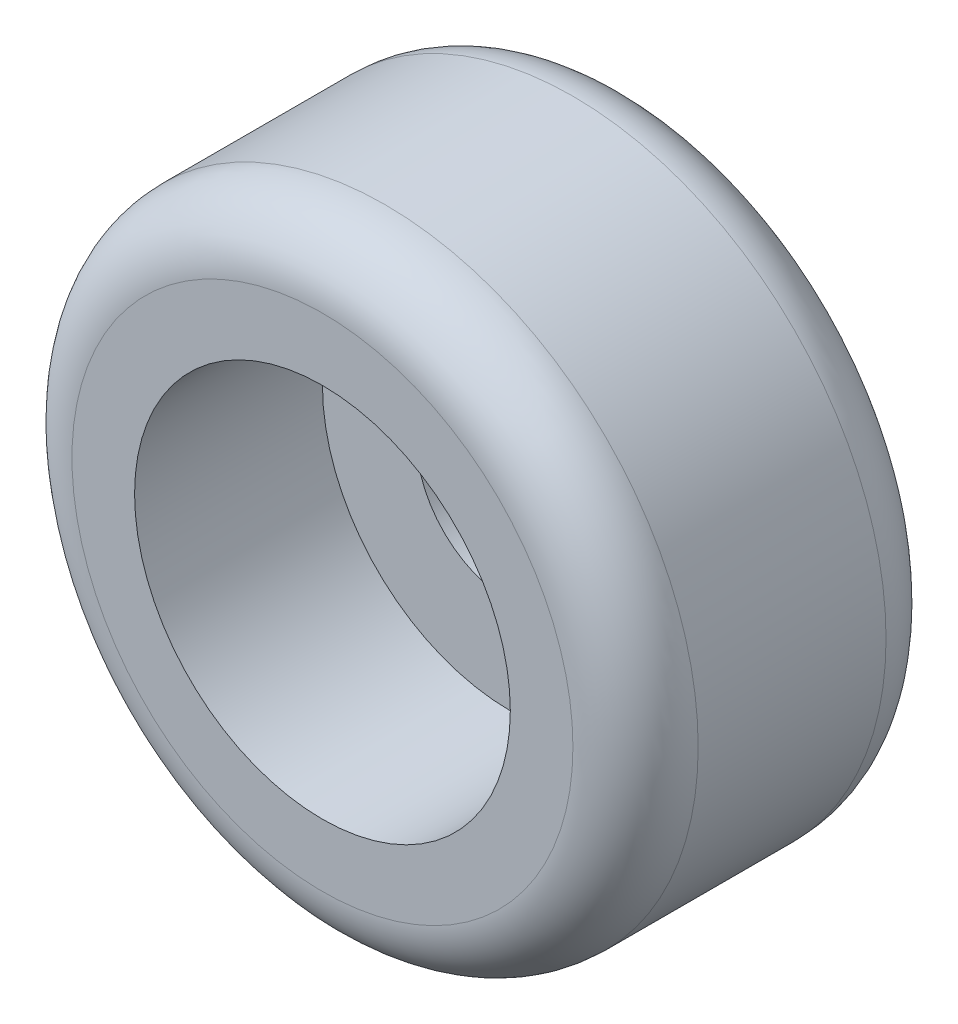
from build123d import *

# Parameters (mm, degrees)
ESQUISSE1_R             = 5
BOSS_EXTRU_1_DEPTH      = 5
ESQUISSE2_R             = 3
ENL_V_MAT_EXTRU_1_DEPTH = 3
ESQUISSE9_R             = 1.5
ENL_V_MAT_EXTRU_2_DEPTH = 3
CHANFREIN1_SIZE         = 1


with BuildPart() as part:
    # Esquisse1 → Boss.-Extru.1 (new body)
    with BuildSketch(Plane.XY):
        Circle(ESQUISSE1_R)
    extrude(amount=BOSS_EXTRU_1_DEPTH)

    # Esquisse2 → Enlèv. mat.-Extru.1 (cut)
    with BuildSketch(Plane.XY.offset(5)):
        Circle(ESQUISSE2_R)
    extrude(amount=-ENL_V_MAT_EXTRU_1_DEPTH, mode=Mode.SUBTRACT)

    # Esquisse3 → Enlèvement de matière-Révolution1 (revolve, cut)
    with BuildSketch(Plane(origin=(0, 0, 0), x_dir=(0, 0, -1), z_dir=(1, 0, 0)), mode=Mode.PRIVATE) as enl_vement_de_mati_re_r_volution1_sk:
        with BuildLine():
            Line((0, 5), (-1, 5))
            ThreePointArc((-1, 5), (-0.292893219, 4.707106781), (0, 4))
            Line((0, 4), (0, 5))
        make_face()
        with BuildLine():
            Line((-4, 5), (-5, 5))
            Line((-5, 5), (-5, 4))
            ThreePointArc((-5, 4), (-4.707106781, 4.707106781), (-4, 5))
        make_face()
    revolve(enl_vement_de_mati_re_r_volution1_sk.sketch.rotate(Axis((0, 0, 5), (0, 0, -1)), 90), axis=Axis((0, 0, 5), (0, 0, -1)), mode=Mode.SUBTRACT)

    # Esquisse9 → Enlèv. mat.-Extru.2 (cut)
    with BuildSketch(Plane(origin=(0, 0, 0), x_dir=(-1, 0, 0), z_dir=(0, 0, -1))):
        Circle(ESQUISSE9_R)
    extrude(amount=-ENL_V_MAT_EXTRU_2_DEPTH, mode=Mode.SUBTRACT)

    # Chanfrein1
    chanfrein1_edges = [part.edges().sort_by_distance(p)[0] for p in [
        (1.5, 0, 0),
    ]]
    chamfer(chanfrein1_edges, length=CHANFREIN1_SIZE)


solid = part.part
